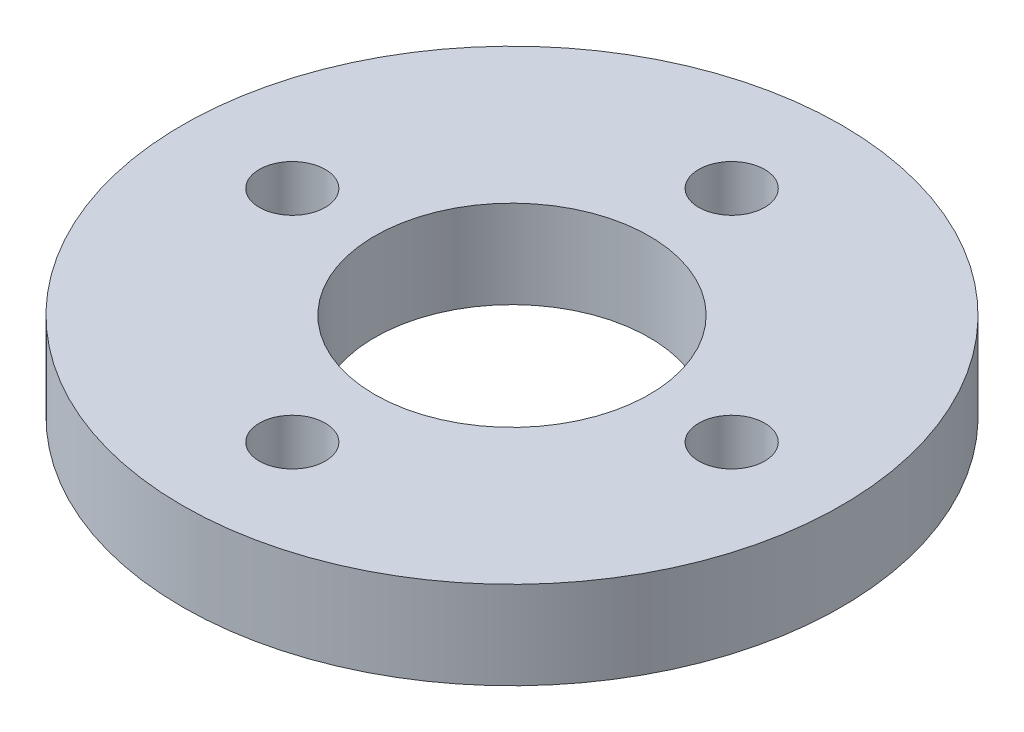
from build123d import *

# Parameters (mm, degrees)
SKETCH_1_R      = 15
SKETCH_1_R_2    = 6.25
SKETCH_1_R_3    = 1.5
EXTRUDE_1_DEPTH = 4


with BuildPart() as part:
    # 草图1 → 凸台-拉伸1 (new body)
    with BuildSketch(Plane(origin=(0, 0, 0), x_dir=(1, 0, 0), z_dir=(0, 1, 0))):
        with Locations(Location((0, 0, 0), (0, 0, 270))):
            Circle(SKETCH_1_R)
        with Locations(Location((0, 0, 0), (0, 0, 270))):
            Circle(SKETCH_1_R_2, mode=Mode.SUBTRACT)
        with Locations(Location((0, 10, 0), (0, 0, 270))):
            Circle(SKETCH_1_R_3, mode=Mode.SUBTRACT)
        with Locations(Location((10, 0, 0), (0, 0, 270))):
            Circle(SKETCH_1_R_3, mode=Mode.SUBTRACT)
        with Locations(Location((0, -10, 0), (0, 0, 270))):
            Circle(SKETCH_1_R_3, mode=Mode.SUBTRACT)
        with Locations(Location((-10, 0, 0), (0, 0, 270))):
            Circle(SKETCH_1_R_3, mode=Mode.SUBTRACT)
    extrude(amount=EXTRUDE_1_DEPTH)


solid = part.part
